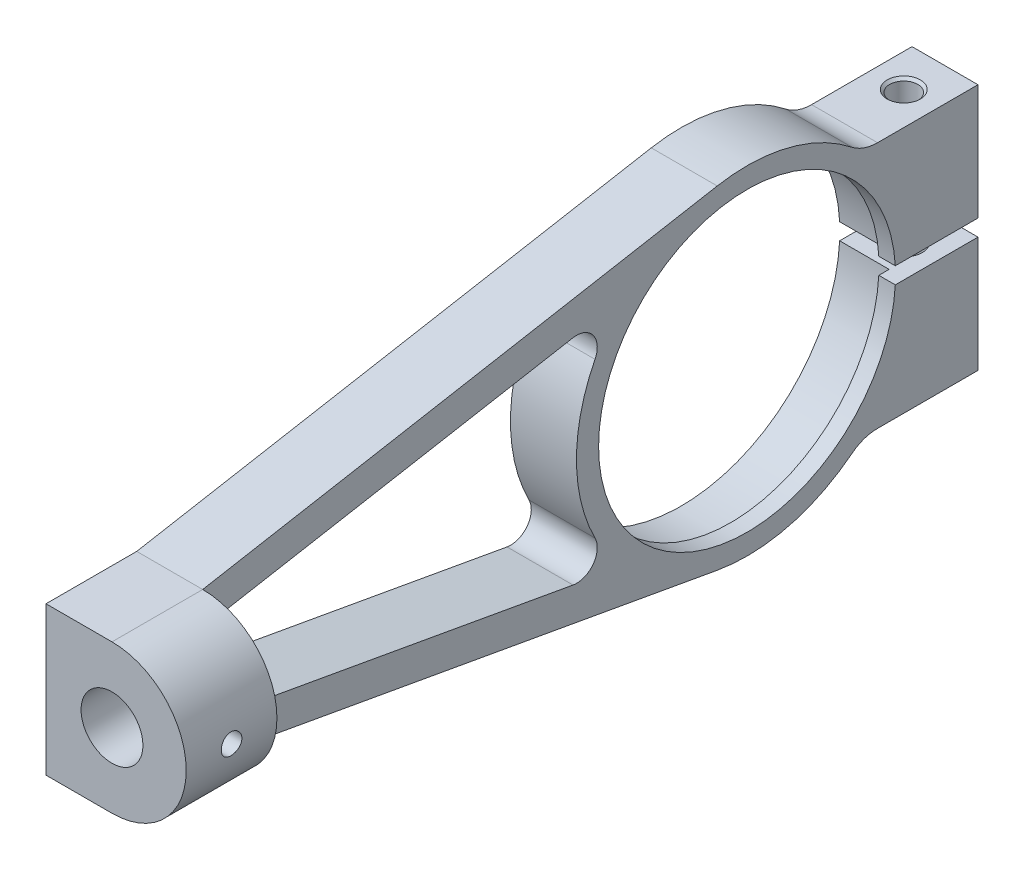
from build123d import *

# Parameters (mm, degrees)
EXTRUDE_1_DEPTH              = 16
SKETCH_3_R                   = 7.5
EXTRUDE_2_DEPTH              = 22
SKETCH_4_R                   = 38.5
CUT_EXTRUDE_1_DEPTH          = 12
CUT_EXTRUDE_2_DEPTH          = 16
CUT_EXTRUDE_3_REACH          = 164.951
CUT_EXTRUDE_3_END_RADIUS     = 18
SKETCH_6_R                   = 2.5
SKETCH_7_R                   = 4.5
CUT_EXTRUDE_4_DEPTH          = 28
HOLE_WIZARD_M8_1_D           = 6.8
HOLE_WIZARD_M8_1_CSINK_D     = 8.05
HOLE_WIZARD_M8_1_CSINK_ANGLE = 90


with BuildPart() as part:
    # 草图1 → 凸台-拉伸1 (new body)
    with BuildSketch(Plane(origin=(0, 0, 0), x_dir=(0, 0, -1), z_dir=(1, 0, 0))):
        with BuildLine():
            Line((-132, 0), (-36, 0))
            ThreePointArc((-36, 0), (-1.000386324, 35.986097693), (35.944401511, 2))
            Line((35.944401511, 2), (56, 2))
            Line((56, 2), (56, 30))
            Line((56, 30), (31.638584039, 30))
            ThreePointArc((31.638584039, 30), (28.354636152, 30.554594436), (25.43494011, 32.156862745))
            ThreePointArc((25.43494011, 32.156862745), (9.982578161, 39.766168199), (-7.231593148, 40.357205807))
            Line((-7.231593148, 40.357205807), (-132, 18))
            Line((-132, 18), (-132, 0))
        make_face()
        with BuildLine():
            ThreePointArc((35.944401511, -2), (-1.000386324, -35.986097693), (-36, 0))
            Line((-36, 0), (-132, 0))
            Line((-132, 0), (-132, -18))
            Line((-132, -18), (-7.231593148, -40.357205807))
            ThreePointArc((-7.231593148, -40.357205807), (9.982578161, -39.766168199), (25.43494011, -32.156862745))
            ThreePointArc((25.43494011, -32.156862745), (28.354636152, -30.554594436), (31.638584039, -30))
            Line((31.638584039, -30), (56, -30))
            Line((56, -30), (56, -2))
            Line((56, -2), (35.944401511, -2))
        make_face()
    extrude(amount=EXTRUDE_1_DEPTH)

    # 草图3 → 凸台-拉伸2 (add)
    with BuildSketch(Plane.XY.offset(132)):
        with BuildLine():
            Line((16, 18), (0, 18))
            Line((0, 18), (0, -18))
            Line((0, -18), (16, -18))
            ThreePointArc((16, -18), (34, 0), (16, 18))
        make_face()
        with Locations(Location((16, 0, 0), (0, 0, 90))):
            Circle(SKETCH_3_R, mode=Mode.SUBTRACT)
    extrude(amount=EXTRUDE_2_DEPTH)

    # 草图4 → 切除-拉伸1 (cut)
    with BuildSketch(Plane.ZY):
        Circle(SKETCH_4_R)
    extrude(amount=-CUT_EXTRUDE_1_DEPTH, mode=Mode.SUBTRACT)

    # 草图5 → 切除-拉伸2 (cut)
    with BuildSketch(Plane(origin=(16, 0, 0), x_dir=(0, 0, -1), z_dir=(1, 0, 0))):
        with BuildLine():
            Line((-132, -9.872579049), (-132, 9.872579049))
            Line((-132, 9.872579049), (-42.206623977, 25.962621701))
            ThreePointArc((-42.206623977, 25.962621701), (-37.309997522, 24.021277058), (-36.869036306, 18.772341655))
            ThreePointArc((-36.869036306, 18.772341655), (-41.373018374, 0), (-36.869036306, -18.772341655))
            ThreePointArc((-36.869036306, -18.772341655), (-37.309997522, -24.021277058), (-42.206623977, -25.962621701))
            Line((-42.206623977, -25.962621701), (-132, -9.872579049))
        make_face()
    extrude(amount=-CUT_EXTRUDE_2_DEPTH, mode=Mode.SUBTRACT)

    # 切除-拉伸3: up to this cylinder (the profile starts inside it)
    cut_extrude_3_end = Plane(origin=(16, 0, 143), z_dir=(0, 0, -1)) * Cylinder(CUT_EXTRUDE_3_END_RADIUS, 366.902, mode=Mode.PRIVATE)
    # 草图6 → 切除-拉伸3 (cut, up to the surface)
    with BuildSketch(Plane.ZY, mode=Mode.PRIVATE) as cut_extrude_3_sk1:
        with Locations((143, 0)):
            Circle(SKETCH_6_R)
    cut_extrude_3_tool1 = extrude(cut_extrude_3_sk1.sketch, amount=-CUT_EXTRUDE_3_REACH, mode=Mode.PRIVATE) & cut_extrude_3_end
    add(cut_extrude_3_tool1.solids().sort_by_distance((0, 0, 143))[0], mode=Mode.SUBTRACT)

    # 草图7 → 切除-拉伸4 (cut)
    with BuildSketch(Plane.XZ.offset(30)):
        with Locations(Location((8, -46, 0), (0, 0, 270))):
            Circle(SKETCH_7_R)
    extrude(amount=-CUT_EXTRUDE_4_DEPTH, mode=Mode.SUBTRACT)

    # M8 螺纹孔1 (through all)
    with Locations(Plane(origin=(0, 30, 0), x_dir=(1, 0, 0), z_dir=(0, 1, 0))):
        with Locations((8, 46)):
            CounterSinkHole(HOLE_WIZARD_M8_1_D / 2, HOLE_WIZARD_M8_1_CSINK_D / 2, counter_sink_angle=HOLE_WIZARD_M8_1_CSINK_ANGLE)


solid = part.part
